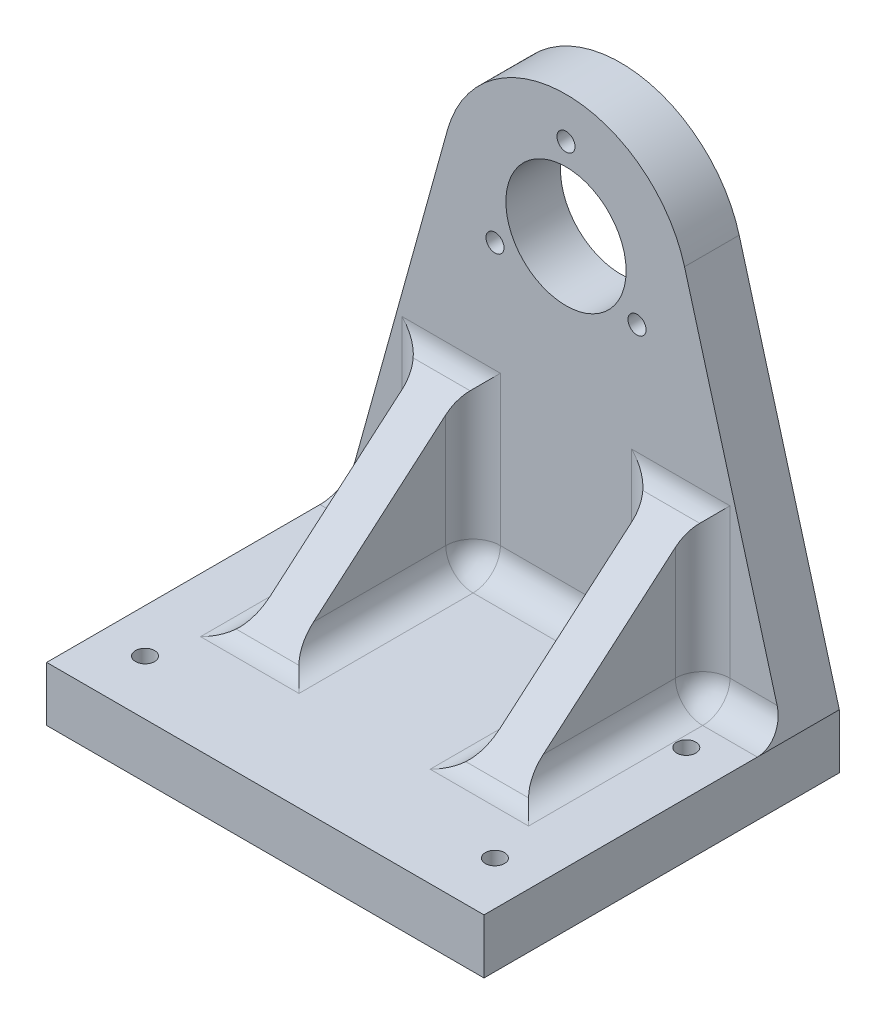
from build123d import *

# Parameters (mm, degrees)
SKETCH1_R           = 1.65
SKETCH1_R_2         = 11
BOSS_EXTRUDE1_DEPTH = 10
SKETCH2_W           = 80
SKETCH2_H           = 10
BOSS_EXTRUDE2_DEPTH = 10
SKETCH3_W           = 80
SKETCH3_H           = 10
BOSS_EXTRUDE3_DEPTH = 55
SKETCH4_W           = 8
SKETCH4_H           = 35
BOSS_EXTRUDE4_DEPTH = 30
CUT_EXTRUDE1_DEPTH  = 157
CUT_EXTRUDE2_DEPTH  = 157
FILLET1_R           = 5


with BuildPart() as part:
    # Sketch1 → Boss-Extrude1 (new body)
    with BuildSketch(Plane.XY):
        with BuildLine():
            ThreePointArc((21.680728295, 6.016312875), (6.9e-07, 22.5), (-21.680727926, 6.016314205))
            Line((-21.680727926, 6.016314205), (-40, -60))
            Line((-40, -60), (40, -60))
            Line((40, -60), (21.680728295, 6.016312875))
        make_face()
        with Locations((0, 15)):
            Circle(SKETCH1_R, mode=Mode.SUBTRACT)
        with Locations((-12.990381057, -7.5)):
            Circle(SKETCH1_R, mode=Mode.SUBTRACT)
        with Locations((12.990381057, -7.5)):
            Circle(SKETCH1_R, mode=Mode.SUBTRACT)
        Circle(SKETCH1_R_2, mode=Mode.SUBTRACT)
    extrude(amount=-BOSS_EXTRUDE1_DEPTH)

    # Sketch2 → Boss-Extrude2 (add)
    with BuildSketch(Plane(origin=(0, -60, 0), x_dir=(-1, 0, 0), z_dir=(0, -1, 0))):
        with Locations((0, 5)):
            Rectangle(SKETCH2_W, SKETCH2_H)
    extrude(amount=BOSS_EXTRUDE2_DEPTH)

    # Sketch3 → Boss-Extrude3 (add)
    with BuildSketch(Plane.XY):
        with Locations((0, -65)):
            Rectangle(SKETCH3_W, SKETCH3_H)
    extrude(amount=BOSS_EXTRUDE3_DEPTH)

    # Sketch4 → Boss-Extrude4 (add)
    with BuildSketch(Plane(origin=(0, -60, 0), x_dir=(1, 0, 0), z_dir=(0, 1, 0))):
        with Locations((-21, -17.5)):
            Rectangle(SKETCH4_W, SKETCH4_H)
        with Locations((21, -17.5)):
            Rectangle(SKETCH4_W, SKETCH4_H)
    extrude(amount=BOSS_EXTRUDE4_DEPTH)

    # Sketch5 → Cut-Extrude1 (cut)
    with BuildSketch(Plane.ZY.offset(25)):
        Polygon((0, -30), (35, -60), (35, -30), align=None)
    extrude(amount=-CUT_EXTRUDE1_DEPTH, mode=Mode.SUBTRACT)

    # Sketch6 → Cut-Extrude2 (cut)
    with BuildSketch(Plane(origin=(0, -60, 0), x_dir=(1, 0, 0), z_dir=(0, 1, 0))):
        with BuildLine():
            ThreePointArc((-33.75, -45), (-33.237436867, -46.237436867), (-32, -46.75))
            Line((-32, -46.75), (-32, -45))
            Line((-32, -45), (-33.75, -45))
        make_face()
        with BuildLine():
            Line((-32, -45), (-32, -46.75))
            ThreePointArc((-32, -46.75), (-30.762563133, -46.237436867), (-30.25, -45))
            ThreePointArc((-30.25, -45), (-32, -43.25), (-33.75, -45))
            Line((-33.75, -45), (-32, -45))
        make_face()
        with BuildLine():
            ThreePointArc((33.75, -45), (30.762563133, -43.762563133), (32, -46.75))
            Line((32, -46.75), (32, -45))
            Line((32, -45), (33.75, -45))
        make_face()
        with BuildLine():
            Line((32, -45), (32, -46.75))
            ThreePointArc((32, -46.75), (33.237436867, -46.237436867), (33.75, -45))
            Line((33.75, -45), (32, -45))
        make_face()
        with BuildLine():
            ThreePointArc((33.75, -10), (33.237436867, -8.762563133), (32, -8.25))
            Line((32, -8.25), (32, -10))
            Line((32, -10), (33.75, -10))
        make_face()
        with BuildLine():
            Line((32, -10), (32, -8.25))
            ThreePointArc((32, -8.25), (30.762563133, -11.237436867), (33.75, -10))
            Line((33.75, -10), (32, -10))
        make_face()
        with BuildLine():
            ThreePointArc((-30.25, -10), (-30.762563133, -8.762563133), (-32, -8.25))
            Line((-32, -8.25), (-32, -10))
            Line((-32, -10), (-33.75, -10))
            ThreePointArc((-33.75, -10), (-32, -11.75), (-30.25, -10))
        make_face()
        with BuildLine():
            Line((-32, -10), (-32, -8.25))
            ThreePointArc((-32, -8.25), (-33.237436867, -8.762563133), (-33.75, -10))
            Line((-33.75, -10), (-32, -10))
        make_face()
    extrude(amount=-CUT_EXTRUDE2_DEPTH, mode=Mode.SUBTRACT)

    # Fillet1
    fillet1_edges = [part.edges().sort_by_distance(p)[0] for p in [
        (32.5, -60, 0),
        (0, -60, 0),
        (-32.5, -60, 0),
        (-21, -60, 35),
        (-17, -60, 17.5),
        (-17, -45, 0),
        (-25, -60, 17.5),
        (-25, -45, 0),
        (-21, -30, 0),
        (17, -45, 0),
        (25, -45, 0),
        (21, -30, 0),
        (17, -60, 17.5),
        (25, -60, 17.5),
        (21, -60, 35),
    ]]
    fillet(fillet1_edges, radius=FILLET1_R)


solid = part.part
